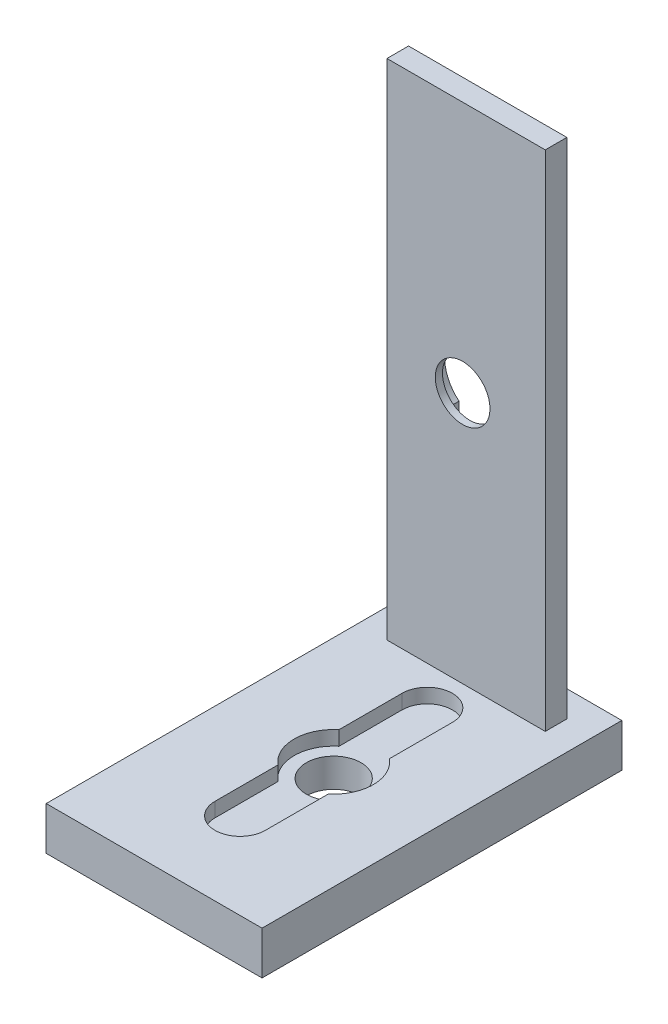
from build123d import *

# Parameters (mm, degrees)
SKETCH_1_W          = 15
SKETCH_1_H          = 25
EXTRUDE_1_DEPTH     = 3
CUT_EXTRUDE_1_DEPTH = 1
SKETCH_3_R          = 1.9
CUT_EXTRUDE_2_DEPTH = 30.223278392
SKETCH_4_W          = 11.000545076
SKETCH_4_H          = 1.5
EXTRUDE_2_DEPTH     = 35
CUT_EXTRUDE_3_DEPTH = 1
SKETCH_6_R          = 1.9
CUT_EXTRUDE_4_DEPTH = 10


with BuildPart() as part:
    # 草图1 → 凸台-拉伸1 (new body)
    with BuildSketch(Plane(origin=(0, 0, 0), x_dir=(1, 0, 0), z_dir=(0, 1, 0))):
        with Locations((7.5, -12.5)):
            Rectangle(SKETCH_1_W, SKETCH_1_H)
    extrude(amount=EXTRUDE_1_DEPTH)

    # 草图2 → 切除-拉伸1 (cut)
    with BuildSketch(Plane(origin=(0, 3, 0), x_dir=(1, 0, 0), z_dir=(0, 1, 0))):
        with BuildLine():
            Line((9.229285522, -6), (9.229285522, -10.378679656))
            ThreePointArc((9.229285522, -10.378679656), (10.229285522, -12.5), (9.229285522, -14.621320344))
            Line((9.229285522, -14.621320344), (9.229285522, -19))
            ThreePointArc((9.229285522, -19), (7.479285522, -20.75), (5.729285522, -19))
            Line((5.729285522, -19), (5.729285522, -14.621320344))
            ThreePointArc((5.729285522, -14.621320344), (4.729285522, -12.5), (5.729285522, -10.378679656))
            Line((5.729285522, -10.378679656), (5.729285522, -6))
            ThreePointArc((5.729285522, -6), (7.479285522, -4.25), (9.229285522, -6))
        make_face()
    extrude(amount=-CUT_EXTRUDE_1_DEPTH, mode=Mode.SUBTRACT)

    # 草图3 → 切除-拉伸2 (cut, through all)
    with BuildSketch(Plane(origin=(0, 2, 0), x_dir=(1, 0, 0), z_dir=(0, 1, 0))):
        with Locations(Location((7.479285522, -12.5, 0), (0, 0, 270))):
            Circle(SKETCH_3_R)
    extrude(amount=-CUT_EXTRUDE_2_DEPTH, mode=Mode.SUBTRACT)

    # 草图4 → 凸台-拉伸2 (add)
    with BuildSketch(Plane(origin=(0, 3, 0), x_dir=(1, 0, 0), z_dir=(0, 1, 0))):
        with Locations((7.500272538, -2.569906393)):
            Rectangle(SKETCH_4_W, SKETCH_4_H)
    extrude(amount=EXTRUDE_2_DEPTH)

    # 草图5 → 切除-拉伸3 (cut)
    with BuildSketch(Plane(origin=(0, 0, 1.819906393), x_dir=(-1, 0, 0), z_dir=(0, 0, -1))):
        with BuildLine():
            Line((-9.008775904, 14), (-9.008775904, 18.378679656))
            ThreePointArc((-9.008775904, 18.378679656), (-10.008775904, 20.5), (-9.008775904, 22.621320344))
            Line((-9.008775904, 22.621320344), (-9.008775904, 27))
            ThreePointArc((-9.008775904, 27), (-7.258775904, 28.75), (-5.508775904, 27))
            Line((-5.508775904, 27), (-5.508775904, 22.621320344))
            ThreePointArc((-5.508775904, 22.621320344), (-4.508775904, 20.5), (-5.508775904, 18.378679656))
            Line((-5.508775904, 18.378679656), (-5.508775904, 14))
            ThreePointArc((-5.508775904, 14), (-7.258775904, 12.25), (-9.008775904, 14))
        make_face()
    extrude(amount=-CUT_EXTRUDE_3_DEPTH, mode=Mode.SUBTRACT)

    # 草图6 → 切除-拉伸4 (cut)
    with BuildSketch(Plane(origin=(0, 0, 2.819906393), x_dir=(-1, 0, 0), z_dir=(0, 0, -1))):
        with Locations((-7.258775904, 20.5)):
            Circle(SKETCH_6_R)
    extrude(amount=-CUT_EXTRUDE_4_DEPTH, mode=Mode.SUBTRACT)


solid = part.part
